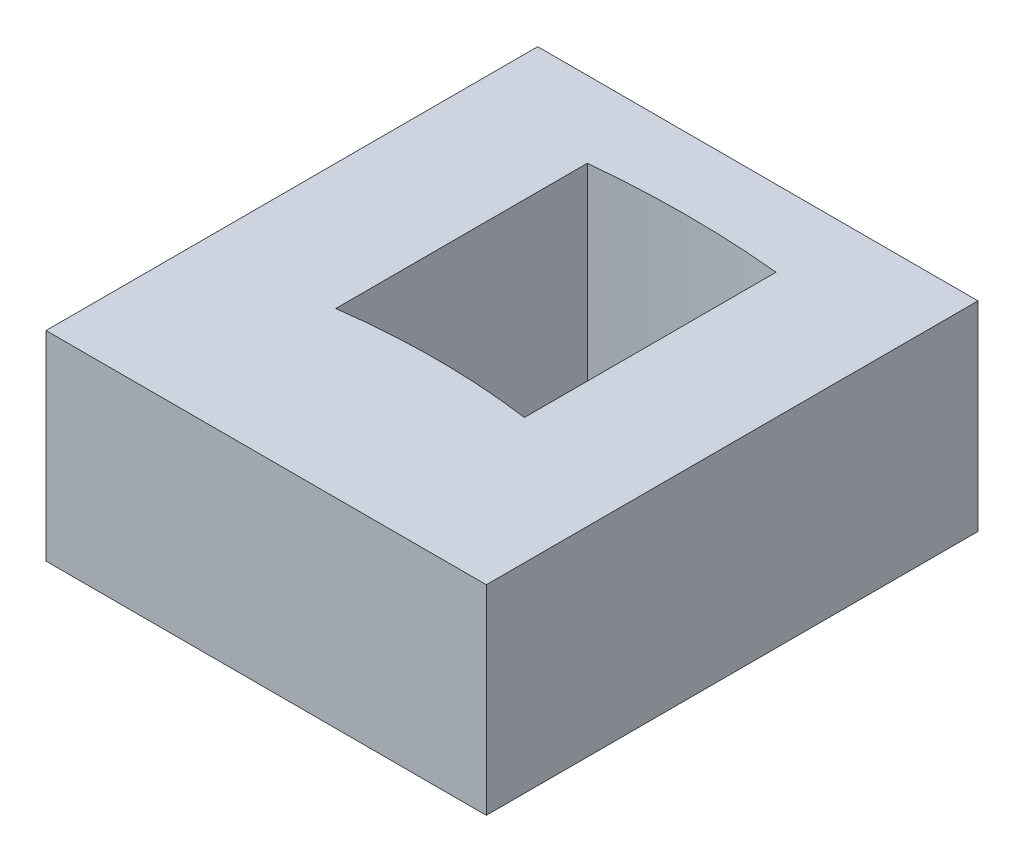
from build123d import *

# Parameters (mm, degrees)
SKETCH1_W           = 7
SKETCH1_H           = 7.816678586
BOSS_EXTRUDE1_DEPTH = 3.175


with BuildPart() as part:
    # Sketch1 → Boss-Extrude1 (new body)
    with BuildSketch(Plane(origin=(0, 0, 0), x_dir=(1, 0, 0), z_dir=(0, 1, 0))):
        with Locations((-0.1, 1.30265391)):
            Rectangle(SKETCH1_W, SKETCH1_H)
        with BuildLine():
            Line((-1.6, 0), (-1.6, 4))
            ThreePointArc((-1.6, 4), (-0.1, 4.075188443), (1.4, 4))
            Line((1.4, 4), (1.4, 0))
            ThreePointArc((1.4, 0), (-0.1, 0.102752641), (-1.6, 0))
        make_face(mode=Mode.SUBTRACT)
    extrude(amount=BOSS_EXTRUDE1_DEPTH)


solid = part.part
